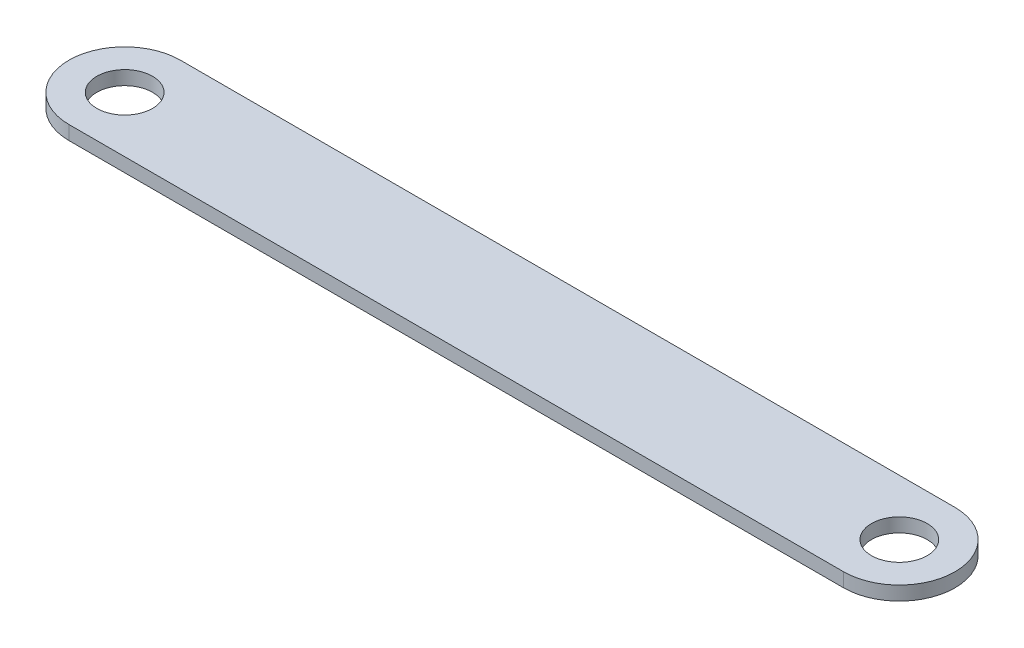
from build123d import *

# Parameters (mm, degrees)
SKETCH1_R           = 6.35
BOSS_EXTRUDE1_DEPTH = 3.175


with BuildPart() as part:
    # Sketch1 → Boss-Extrude1 (new body)
    with BuildSketch(Plane(origin=(0, 0, 0), x_dir=(1, 0, 0), z_dir=(0, 1, 0))):
        with BuildLine():
            Line((0, 12.7), (176.54778, 12.7))
            ThreePointArc((176.54778, 12.7), (189.24778, 0), (176.54778, -12.7))
            Line((176.54778, -12.7), (0, -12.7))
            ThreePointArc((0, -12.7), (-12.7, 0), (0, 12.7))
        make_face()
        with Locations(Location((0, 0, 0), (0, 0, 270))):
            Circle(SKETCH1_R, mode=Mode.SUBTRACT)
        with Locations(Location((176.54778, 0, 0), (0, 0, 270))):
            Circle(SKETCH1_R, mode=Mode.SUBTRACT)
    extrude(amount=BOSS_EXTRUDE1_DEPTH)


solid = part.part
